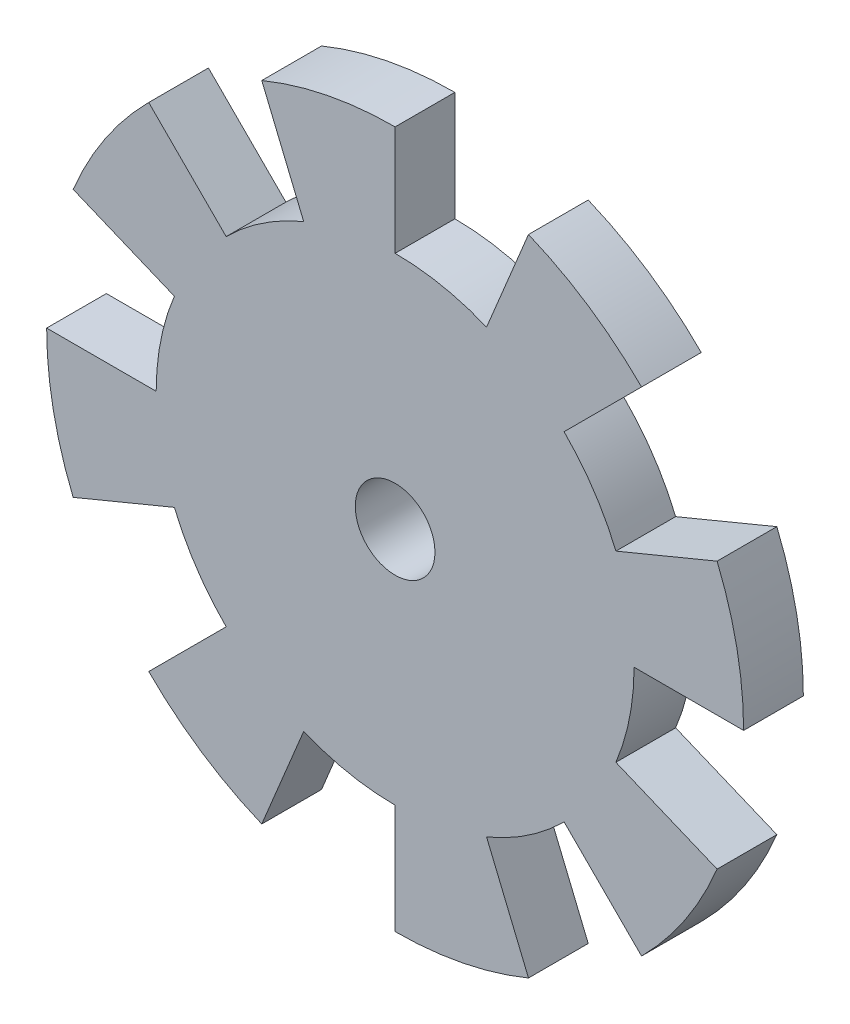
from build123d import *

# Parameters (mm, degrees)
SKETCH1_R           = 4
BOSS_EXTRUDE1_DEPTH = 6


with BuildPart() as part:
    # Sketch1 → Boss-Extrude1 (new body)
    with BuildSketch(Plane.XY):
        with BuildLine():
            Line((-13.393920133, 32.335783638), (-9.184402377, 22.17310878))
            ThreePointArc((-9.184402377, 22.17310878), (-13.333685592, 19.955270695), (-16.970562748, 16.970562748))
            Line((-16.970562748, 16.970562748), (-24.748737342, 24.748737342))
            ThreePointArc((-24.748737342, 24.748737342), (-29.101436431, 19.444958156), (-32.335783638, 13.393920133))
            Line((-32.335783638, 13.393920133), (-22.17310878, 9.184402377))
            ThreePointArc((-22.17310878, 9.184402377), (-23.53884673, 4.682167728), (-24, 0))
            Line((-24, 0), (-35, 0))
            ThreePointArc((-35, 0), (-34.327484814, -6.828161271), (-32.335783638, -13.393920133))
            Line((-32.335783638, -13.393920133), (-22.17310878, -9.184402377))
            ThreePointArc((-22.17310878, -9.184402377), (-19.955270695, -13.333685592), (-16.970562748, -16.970562748))
            Line((-16.970562748, -16.970562748), (-24.748737342, -24.748737342))
            ThreePointArc((-24.748737342, -24.748737342), (-19.444958156, -29.101436431), (-13.393920133, -32.335783638))
            Line((-13.393920133, -32.335783638), (-9.184402377, -22.17310878))
            ThreePointArc((-9.184402377, -22.17310878), (-4.682167728, -23.53884673), (0, -24))
            Line((0, -24), (0, -35))
            ThreePointArc((0, -35), (6.828161271, -34.327484814), (13.393920133, -32.335783638))
            Line((13.393920133, -32.335783638), (9.184402377, -22.17310878))
            ThreePointArc((9.184402377, -22.17310878), (13.333685592, -19.955270695), (16.970562748, -16.970562748))
            Line((16.970562748, -16.970562748), (24.748737342, -24.748737342))
            ThreePointArc((24.748737342, -24.748737342), (29.101436431, -19.444958156), (32.335783638, -13.393920133))
            Line((32.335783638, -13.393920133), (22.17310878, -9.184402377))
            ThreePointArc((22.17310878, -9.184402377), (23.53884673, -4.682167728), (24, 0))
            Line((24, 0), (35, 0))
            ThreePointArc((35, 0), (34.327484814, 6.828161271), (32.335783638, 13.393920133))
            Line((32.335783638, 13.393920133), (22.17310878, 9.184402377))
            ThreePointArc((22.17310878, 9.184402377), (19.955270695, 13.333685592), (16.970562748, 16.970562748))
            Line((16.970562748, 16.970562748), (24.748737342, 24.748737342))
            ThreePointArc((24.748737342, 24.748737342), (19.444958156, 29.101436431), (13.393920133, 32.335783638))
            Line((13.393920133, 32.335783638), (9.184402377, 22.17310878))
            ThreePointArc((9.184402377, 22.17310878), (4.682167728, 23.53884673), (0, 24))
            Line((0, 24), (0, 35))
            ThreePointArc((0, 35), (-6.828161271, 34.327484814), (-13.393920133, 32.335783638))
        make_face()
        Circle(SKETCH1_R, mode=Mode.SUBTRACT)
    extrude(amount=BOSS_EXTRUDE1_DEPTH)


solid = part.part
